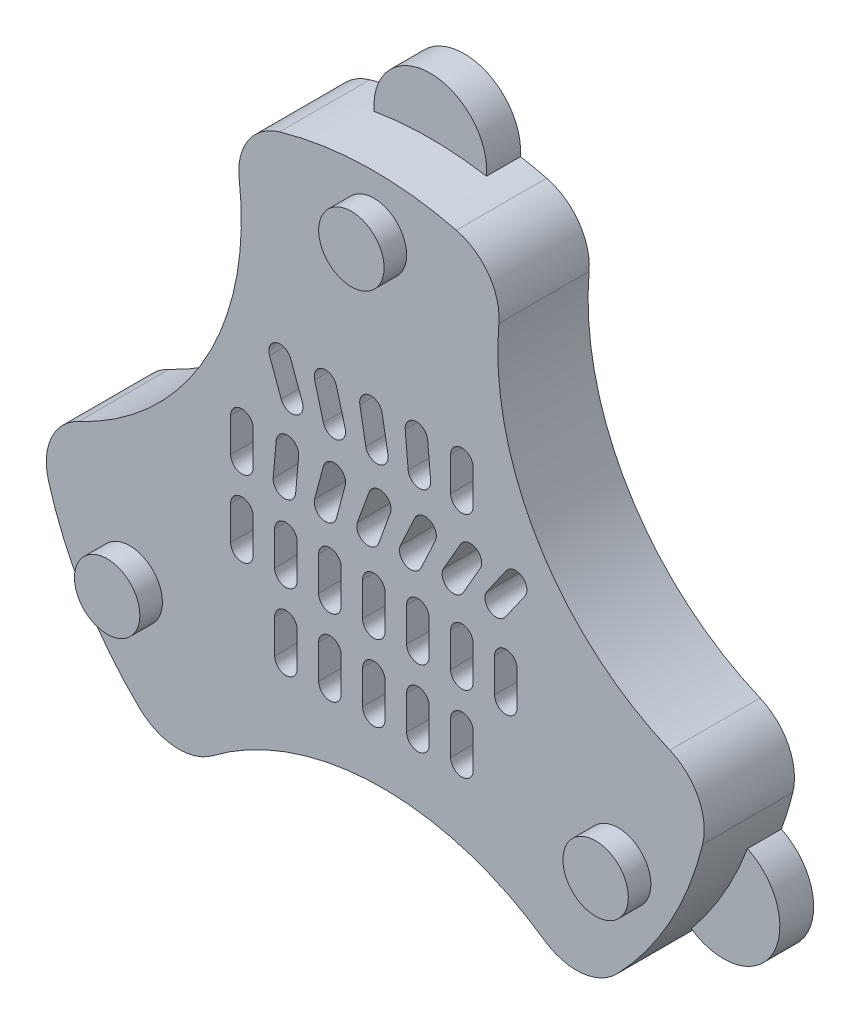
from build123d import *

# Parameters (mm, degrees)
SKETCH2_R           = 18.85
BOSS_EXTRUDE1_DEPTH = 8
SKETCH3_R           = 30
SKETCH3_R_2         = 17.600030795
BOSS_EXTRUDE2_DEPTH = 8
SKETCH4_R           = 2.9
BOSS_EXTRUDE3_DEPTH = 2
SKETCH6_R           = 5
BOSS_EXTRUDE4_DEPTH = 3
SKETCH5_R           = 3
CUT_EXTRUDE1_DEPTH  = 3
SKETCH7_R           = 25
CUT_EXTRUDE2_DEPTH  = 8
FILLET1_R           = 5


with BuildPart() as part:
    # Sketch2 → Boss-Extrude1 (new body)
    with BuildSketch(Plane.XY.offset(10)):
        Circle(SKETCH2_R)
        with BuildLine():
            Line((4.764111012, 11.713944834), (5.02557824, 8.72536074))
            ThreePointArc((5.02557824, 8.72536074), (4.116539285, 7.642010299), (3.033188844, 8.551049254))
            Line((3.033188844, 8.551049254), (2.771721616, 11.539633349))
            ThreePointArc((2.771721616, 11.539633349), (3.680760571, 12.62298379), (4.764111012, 11.713944834))
        make_face(mode=Mode.SUBTRACT)
        with BuildLine():
            Line((0.721986022, 11.783756617), (1.242930555, 8.829333358))
            ThreePointArc((1.242930555, 8.829333358), (0.431770979, 7.670877427), (-0.726684951, 8.482037002))
            Line((-0.726684951, 8.482037002), (-1.247629484, 11.436460261))
            ThreePointArc((-1.247629484, 11.436460261), (-0.436469909, 12.594916192), (0.721986022, 11.783756617))
        make_face(mode=Mode.SUBTRACT)
        with BuildLine():
            Line((-3.324652206, 11.840604594), (-2.548195071, 8.942827115))
            ThreePointArc((-2.548195071, 8.942827115), (-3.255301852, 7.718082244), (-4.480046723, 8.425189025))
            Line((-4.480046723, 8.425189025), (-5.256503859, 11.322966504))
            ThreePointArc((-5.256503859, 11.322966504), (-4.549397078, 12.547711375), (-3.324652206, 11.840604594))
        make_face(mode=Mode.SUBTRACT)
        with BuildLine():
            Line((-7.374687666, 11.884056119), (-6.348627236, 9.064978256))
            ThreePointArc((-6.348627236, 9.064978256), (-6.946299713, 7.783265492), (-8.228012478, 8.38093797))
            Line((-8.228012478, 8.38093797), (-9.254072908, 11.200015832))
            ThreePointArc((-9.254072908, 11.200015832), (-8.65640043, 12.481728596), (-7.374687666, 11.884056119))
        make_face(mode=Mode.SUBTRACT)
        with BuildLine():
            Line((10.016532673, 2.722847178), (11.737262197, 5.180303618))
            ThreePointArc((11.737262197, 5.180303618), (13.129990678, 5.425879226), (13.375566285, 4.033150745))
            Line((13.375566285, 4.033150745), (11.654836761, 1.575694305))
            ThreePointArc((11.654836761, 1.575694305), (10.262108281, 1.330118697), (10.016532673, 2.722847178))
        make_face(mode=Mode.SUBTRACT)
        with BuildLine():
            Line((6.180023981, 2.578960693), (7.680024169, 5.17703723))
            ThreePointArc((7.680024169, 5.17703723), (9.046049573, 5.543062633), (9.412074977, 4.17703723))
            Line((9.412074977, 4.17703723), (7.912074789, 1.578960693))
            ThreePointArc((7.912074789, 1.578960693), (6.546049385, 1.212935289), (6.180023981, 2.578960693))
        make_face(mode=Mode.SUBTRACT)
        with BuildLine():
            Line((2.35581422, 2.441155373), (3.623669164, 5.160079074))
            ThreePointArc((3.623669164, 5.160079074), (4.952595213, 5.643768599), (5.436284738, 4.31484255))
            Line((5.436284738, 4.31484255), (4.168429794, 1.595918849))
            ThreePointArc((4.168429794, 1.595918849), (2.839503745, 1.112229324), (2.35581422, 2.441155373))
        make_face(mode=Mode.SUBTRACT)
        with BuildLine():
            Line((-1.456673421, 2.310479997), (-0.430612863, 5.129558212))
            ThreePointArc((-0.430612863, 5.129558212), (0.851099902, 5.72723069), (1.448772379, 4.445517926))
            Line((1.448772379, 4.445517926), (0.422711821, 1.626439711))
            ThreePointArc((0.422711821, 1.626439711), (-0.859000943, 1.028767233), (-1.456673421, 2.310479997))
        make_face(mode=Mode.SUBTRACT)
        with BuildLine():
            Line((-5.258104963, 2.187929086), (-4.481647731, 5.085706927))
            ThreePointArc((-4.481647731, 5.085706927), (-3.25690286, 5.792813708), (-2.549796078, 4.568068837))
            Line((-2.549796078, 4.568068837), (-3.326253311, 1.670290996))
            ThreePointArc((-3.326253311, 1.670290996), (-4.550998182, 0.963184214), (-5.258104963, 2.187929086))
        make_face(mode=Mode.SUBTRACT)
        with BuildLine():
            Line((-8.92962778, 1.970363305), (-8.668160552, 4.958947399))
            ThreePointArc((-8.668160552, 4.958947399), (-7.584810111, 5.867986354), (-6.675771155, 4.784635913))
            Line((-6.675771155, 4.784635913), (-6.937238384, 1.796051819))
            ThreePointArc((-6.937238384, 1.796051819), (-8.020588824, 0.887012864), (-8.92962778, 1.970363305))
        make_face(mode=Mode.SUBTRACT)
        with BuildLine():
            Line((-12.703950937, 1.877998774), (-12.703950937, 4.877999149))
            ThreePointArc((-12.703950937, 4.877999149), (-11.703950937, 5.877999149), (-10.703950937, 4.877999149))
            Line((-10.703950937, 4.877999149), (-10.703950937, 1.877998774))
            ThreePointArc((-10.703950937, 1.877998774), (-11.703950937, 0.877998774), (-12.703950937, 1.877998774))
        make_face(mode=Mode.SUBTRACT)
        with BuildLine():
            Line((10.694050788, -4.877759835), (10.694050788, -1.877757303))
            ThreePointArc((10.694050788, -1.877757303), (11.694050788, -0.877757303), (12.694050788, -1.877757303))
            Line((12.694050788, -1.877757303), (12.694050788, -4.877759835))
            ThreePointArc((12.694050788, -4.877759835), (11.694050788, -5.877759835), (10.694050788, -4.877759835))
        make_face(mode=Mode.SUBTRACT)
        with BuildLine():
            Line((6.794050788, -4.877759835), (6.794050788, -1.877757303))
            ThreePointArc((6.794050788, -1.877757303), (7.794050788, -0.877757303), (8.794050788, -1.877757303))
            Line((8.794050788, -1.877757303), (8.794050788, -4.877759835))
            ThreePointArc((8.794050788, -4.877759835), (7.794050788, -5.877759835), (6.794050788, -4.877759835))
        make_face(mode=Mode.SUBTRACT)
        with BuildLine():
            Line((2.894050788, -4.877759835), (2.894050788, -1.877757303))
            ThreePointArc((2.894050788, -1.877757303), (3.894050788, -0.877757303), (4.894050788, -1.877757303))
            Line((4.894050788, -1.877757303), (4.894050788, -4.877759835))
            ThreePointArc((4.894050788, -4.877759835), (3.894050788, -5.877759835), (2.894050788, -4.877759835))
        make_face(mode=Mode.SUBTRACT)
        with BuildLine():
            Line((-1.005949212, -4.877759835), (-1.005949212, -1.877757303))
            ThreePointArc((-1.005949212, -1.877757303), (-0.005949212, -0.877757303), (0.994050788, -1.877757303))
            Line((0.994050788, -1.877757303), (0.994050788, -4.877759835))
            ThreePointArc((0.994050788, -4.877759835), (-0.005949212, -5.877759835), (-1.005949212, -4.877759835))
        make_face(mode=Mode.SUBTRACT)
        with BuildLine():
            Line((-4.905949212, -4.877759835), (-4.905949212, -1.877757303))
            ThreePointArc((-4.905949212, -1.877757303), (-3.905949212, -0.877757303), (-2.905949212, -1.877757303))
            Line((-2.905949212, -1.877757303), (-2.905949212, -4.877759835))
            ThreePointArc((-2.905949212, -4.877759835), (-3.905949212, -5.877759835), (-4.905949212, -4.877759835))
        make_face(mode=Mode.SUBTRACT)
        with BuildLine():
            Line((-8.804648155, -4.877758985), (-8.800750037, -1.877761517))
            ThreePointArc((-8.800750037, -1.877761517), (-7.799451508, -0.879061734), (-6.800751725, -1.880360263))
            Line((-6.800751725, -1.880360263), (-6.804649843, -4.88035773))
            ThreePointArc((-6.804649843, -4.88035773), (-7.805948372, -5.879057513), (-8.804648155, -4.877758985))
        make_face(mode=Mode.SUBTRACT)
        with BuildLine():
            Line((-12.705949212, -4.877759835), (-12.705949212, -1.877757303))
            ThreePointArc((-12.705949212, -1.877757303), (-11.705949212, -0.877757303), (-10.705949212, -1.877757303))
            Line((-10.705949212, -1.877757303), (-10.705949212, -4.877759835))
            ThreePointArc((-10.705949212, -4.877759835), (-11.705949212, -5.877759835), (-12.705949212, -4.877759835))
        make_face(mode=Mode.SUBTRACT)
        with BuildLine():
            Line((8.799250647, -8.635615621), (8.799250647, -11.635615621))
            ThreePointArc((8.799250647, -11.635615621), (7.799250647, -12.635615621), (6.799250647, -11.635615621))
            Line((6.799250647, -11.635615621), (6.799250647, -8.635615621))
            ThreePointArc((6.799250647, -8.635615621), (7.799250647, -7.635615621), (8.799250647, -8.635615621))
        make_face(mode=Mode.SUBTRACT)
        with BuildLine():
            Line((4.899250647, -8.635615621), (4.899250647, -11.635615621))
            ThreePointArc((4.899250647, -11.635615621), (3.899250647, -12.635615621), (2.899250647, -11.635615621))
            Line((2.899250647, -11.635615621), (2.899250647, -8.635615621))
            ThreePointArc((2.899250647, -8.635615621), (3.899250647, -7.635615621), (4.899250647, -8.635615621))
        make_face(mode=Mode.SUBTRACT)
        with BuildLine():
            Line((0.999250647, -8.635615621), (0.999250647, -11.635615621))
            ThreePointArc((0.999250647, -11.635615621), (-0.000749353, -12.635615621), (-1.000749353, -11.635615621))
            Line((-1.000749353, -11.635615621), (-1.000749353, -8.635615621))
            ThreePointArc((-1.000749353, -8.635615621), (-0.000749353, -7.635615621), (0.999250647, -8.635615621))
        make_face(mode=Mode.SUBTRACT)
        with BuildLine():
            Line((-2.900749353, -8.635615621), (-2.900749353, -11.635615621))
            ThreePointArc((-2.900749353, -11.635615621), (-3.900749353, -12.635615621), (-4.900749353, -11.635615621))
            Line((-4.900749353, -11.635615621), (-4.900749353, -8.635615621))
            ThreePointArc((-4.900749353, -8.635615621), (-3.900749353, -7.635615621), (-2.900749353, -8.635615621))
        make_face(mode=Mode.SUBTRACT)
        with BuildLine():
            Line((-6.800749353, -8.635615621), (-6.800749353, -11.635615621))
            ThreePointArc((-6.800749353, -11.635615621), (-7.800749353, -12.635615621), (-8.800749353, -11.635615621))
            Line((-8.800749353, -11.635615621), (-8.800749353, -8.635615621))
            ThreePointArc((-8.800749353, -8.635615621), (-7.800749353, -7.635615621), (-6.800749353, -8.635615621))
        make_face(mode=Mode.SUBTRACT)
        with BuildLine():
            Line((8.797649477, 11.632897752), (8.797649477, 8.632897752))
            ThreePointArc((8.797649477, 8.632897752), (7.797649477, 7.632897752), (6.797649477, 8.632897752))
            Line((6.797649477, 8.632897752), (6.797649477, 11.632897752))
            ThreePointArc((6.797649477, 11.632897752), (7.797649477, 12.632897752), (8.797649477, 11.632897752))
        make_face(mode=Mode.SUBTRACT)
    extrude(amount=BOSS_EXTRUDE1_DEPTH)

    # Sketch3 → Boss-Extrude2 (add)
    with BuildSketch(Plane.XY.offset(18)):
        Circle(SKETCH3_R)
        Circle(SKETCH3_R_2, mode=Mode.SUBTRACT)
    extrude(amount=-BOSS_EXTRUDE2_DEPTH)

    # Sketch4 → Boss-Extrude3 (add)
    with BuildSketch(Plane.XY.offset(18)):
        with Locations((0, 25)):
            Circle(SKETCH4_R)
        with Locations((21.650635095, -12.5)):
            Circle(SKETCH4_R)
        with Locations((-21.650635095, -12.5)):
            Circle(SKETCH4_R)
    extrude(amount=BOSS_EXTRUDE3_DEPTH)

    # Sketch6 → Boss-Extrude4 (add)
    with BuildSketch(Plane(origin=(0, 0, 10), x_dir=(-1, 0, 0), z_dir=(0, 0, -1))):
        with Locations((0, 30)):
            Circle(SKETCH6_R)
        with Locations((25.980762114, -15)):
            Circle(SKETCH6_R)
        with Locations((-25.980762114, -15)):
            Circle(SKETCH6_R)
    extrude(amount=-BOSS_EXTRUDE4_DEPTH)

    # Sketch5 → Cut-Extrude1 (cut)
    with BuildSketch(Plane(origin=(0, 0, 10), x_dir=(-1, 0, 0), z_dir=(0, 0, -1))):
        with Locations((0, 25)):
            Circle(SKETCH5_R)
        with Locations((21.650635095, -12.5)):
            Circle(SKETCH5_R)
        with Locations((-21.650635095, -12.5)):
            Circle(SKETCH5_R)
    extrude(amount=-CUT_EXTRUDE1_DEPTH, mode=Mode.SUBTRACT)

    # Sketch7 → Cut-Extrude2 (cut)
    with BuildSketch(Plane(origin=(0, 0, 10), x_dir=(-1, 0, 0), z_dir=(0, 0, -1))):
        with Locations((-35.980083702, 21.666415873)):
            Circle(SKETCH7_R)
        with Locations((36.753708406, 20.32645858)):
            Circle(SKETCH7_R)
        with Locations((-0.773624703, -41.992874453)):
            Circle(SKETCH7_R)
    extrude(amount=-CUT_EXTRUDE2_DEPTH, mode=Mode.SUBTRACT)

    # Fillet1
    fillet1_edges = [part.edges().sort_by_distance(p)[0] for p in [
        (29.888839754, -2.580166302, 14),
        (11.700383981, 27.624283062, 14),
        (-12.709930313, 27.174577668, 14),
        (-29.773522884, -3.679311769, 14),
        (-17.178909441, -24.594411366, 14),
        (18.073138902, -23.944971293, 14),
    ]]
    fillet(fillet1_edges, radius=FILLET1_R)


solid = part.part
